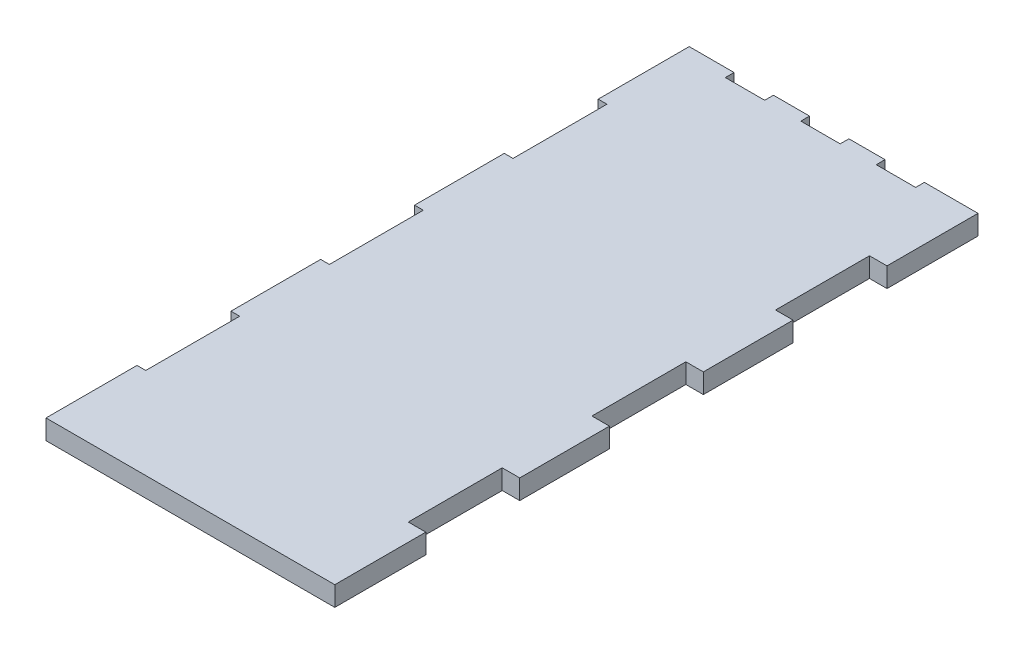
from build123d import *

# Parameters (mm, degrees)
SKETCH_4_W      = 60
SKETCH_4_H      = 145
EXTRUDE_1_DEPTH = 4.5
SKETCH_5_W      = 8.25
SKETCH_5_H      = 4.5
EXTRUDE_2_DEPTH = 2
SKETCH_7_W      = 20.8
SKETCH_7_H      = 4.5
SKETCH_7_W_2    = 20.5
EXTRUDE_3_DEPTH = 4
EXTRUDE_START   = -60
SKETCH_7_2_W    = 20.8
SKETCH_7_2_H    = 4.5
SKETCH_7_2_W_2  = 20.5
EXTRUDE_4_DEPTH = 2
EXTRUDE_START_2 = -2.2
EXTRUDE_5_DEPTH = 142.8


with BuildPart() as part:
    # 草图4 → 凸台-拉伸1 (new body)
    with BuildSketch(Plane(origin=(0, 0, 0), x_dir=(1, 0, 0), z_dir=(0, 1, 0))):
        Rectangle(SKETCH_4_W, SKETCH_4_H)
    extrude(amount=EXTRUDE_1_DEPTH)

    # 草图5 → 凸台-拉伸2 (add)
    with BuildSketch(Plane(origin=(0, 0, -72.5), x_dir=(-1, 0, 0), z_dir=(0, 0, -1))):
        with Locations((-25.875, 2.25)):
            Rectangle(SKETCH_5_W, SKETCH_5_H)
        with Locations((-8.625, 2.25)):
            Rectangle(SKETCH_5_W, SKETCH_5_H)
        with Locations((8.625, 2.25)):
            Rectangle(SKETCH_5_W, SKETCH_5_H)
        with Locations((25.875, 2.25)):
            Rectangle(SKETCH_5_W, SKETCH_5_H)
    extrude(amount=EXTRUDE_2_DEPTH)

    # 草图7 → 凸台-拉伸3 (add)
    with BuildSketch(Plane(origin=(30, 0, 0), x_dir=(0, 0, -1), z_dir=(1, 0, 0))):
        with Locations((-62.1, 2.25)):
            Rectangle(SKETCH_7_W, SKETCH_7_H)
        with Locations((-19.983333333, 2.25)):
            Rectangle(SKETCH_7_W_2, SKETCH_7_H)
        with Locations((21.983333333, 2.25)):
            Rectangle(SKETCH_7_W_2, SKETCH_7_H)
        with Locations((64.1, 2.25)):
            Rectangle(SKETCH_7_W, SKETCH_7_H)
    extrude(amount=EXTRUDE_3_DEPTH)

    # 草图7<2> → 凸台-拉伸4 (add)
    with BuildSketch(Plane(origin=(30, 0, 0), x_dir=(0, 0, -1), z_dir=(1, 0, 0)).offset(EXTRUDE_START)):
        with Locations((-62.1, 2.25)):
            Rectangle(SKETCH_7_2_W, SKETCH_7_2_H)
        with Locations((-19.983333333, 2.25)):
            Rectangle(SKETCH_7_2_W_2, SKETCH_7_2_H)
        with Locations((21.983333333, 2.25)):
            Rectangle(SKETCH_7_2_W_2, SKETCH_7_2_H)
        with Locations((64.1, 2.25)):
            Rectangle(SKETCH_7_2_W, SKETCH_7_2_H)
    extrude(amount=-EXTRUDE_4_DEPTH)

    # 草图9 → 凸台-拉伸5 (add)
    with BuildSketch(Plane.XY.offset(72.5).offset(EXTRUDE_START_2)):
        Polygon((-9.8, 0), (-11.6, -1.8), (-9.8, -1.8), (9.8, -1.8), (11.6, -1.8), (9.8, 0), align=None)
    extrude(amount=-EXTRUDE_5_DEPTH)


solid = part.part
